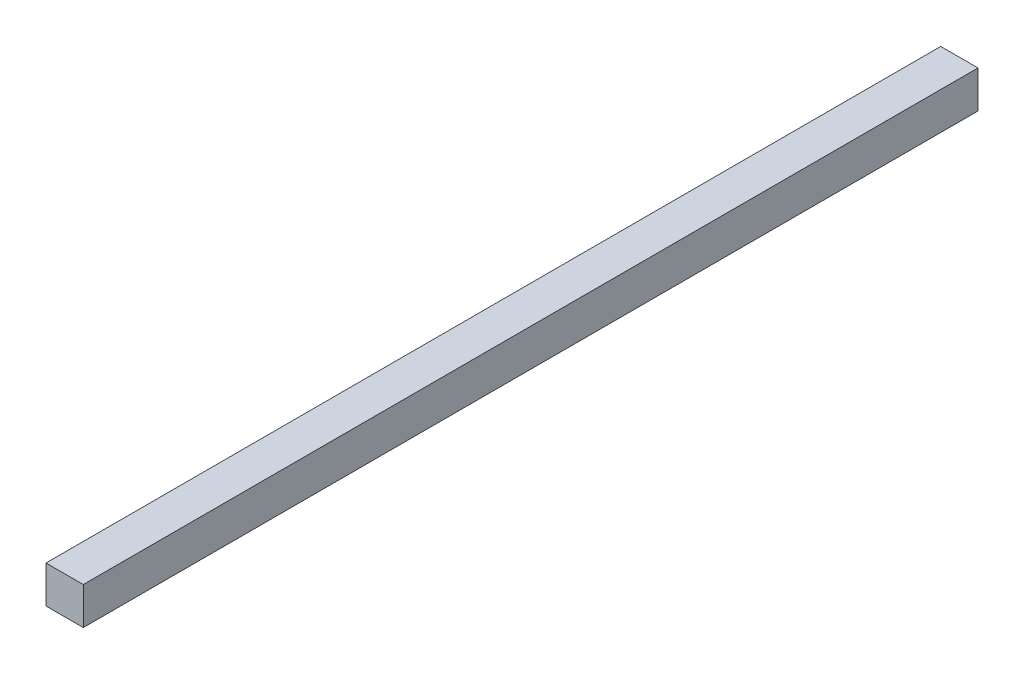
from build123d import *

# Parameters (mm, degrees)
SKETCH2_W           = 6.35
SKETCH2_H           = 6.35
BOSS_EXTRUDE1_DEPTH = 152.4


with BuildPart() as part:
    # Sketch2 → Boss-Extrude1 (new body)
    with BuildSketch(Plane.XY):
        with Locations((3.175, 3.175)):
            Rectangle(SKETCH2_W, SKETCH2_H)
    extrude(amount=BOSS_EXTRUDE1_DEPTH)


solid = part.part
